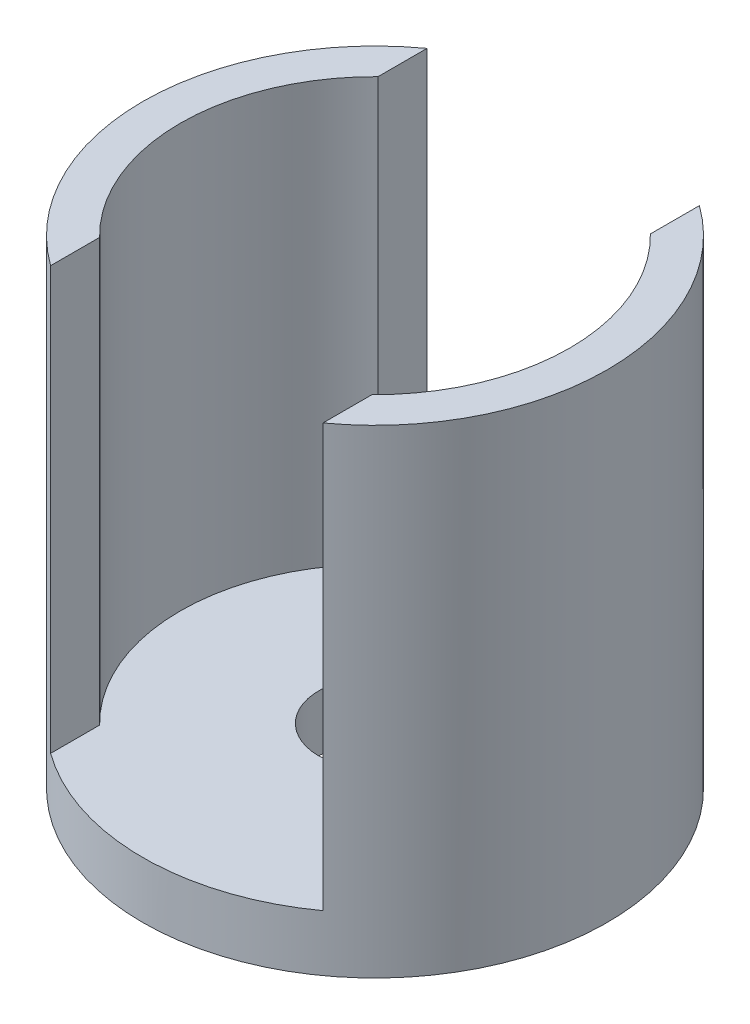
from build123d import *

# Parameters (mm, degrees)
SKETCH2_R           = 8.25
SKETCH2_R_2         = 2
BOSS_EXTRUDE1_DEPTH = 2
BOSS_EXTRUDE2_DEPTH = 15


with BuildPart() as part:
    # Sketch2 → Boss-Extrude1 (new body)
    with BuildSketch(Plane(origin=(0, 0, 0), x_dir=(1, 0, 0), z_dir=(0, 1, 0))):
        with Locations(Location((0, 0, 0), (0, 0, 270))):
            Circle(SKETCH2_R)
        with Locations(Location((0, 0, 0), (0, 0, 270))):
            Circle(SKETCH2_R_2, mode=Mode.SUBTRACT)
    extrude(amount=BOSS_EXTRUDE1_DEPTH)

    # Sketch3 → Boss-Extrude2 (add)
    with BuildSketch(Plane(origin=(0, 2, 0), x_dir=(1, 0, 0), z_dir=(0, 1, 0))):
        with BuildLine():
            ThreePointArc((-4.836821281, 6.683386858), (-8.25, 0), (-4.836821281, -6.683386858))
            Line((-4.836821281, -6.683386858), (-4.836821281, -4.942960119))
            ThreePointArc((-4.836821281, -4.942960119), (-6.915756997, 0), (-4.836821281, 4.942960119))
            Line((-4.836821281, 4.942960119), (-4.836821281, 6.683386858))
        make_face()
        with BuildLine():
            Line((4.836821281, -4.942960119), (4.836821281, -6.683386858))
            ThreePointArc((4.836821281, -6.683386858), (7.34732181, -3.752247622), (8.25, 0))
            ThreePointArc((8.25, 0), (7.34732181, 3.752247622), (4.836821281, 6.683386858))
            Line((4.836821281, 6.683386858), (4.836821281, 4.942960119))
            ThreePointArc((4.836821281, 4.942960119), (6.374871585, 2.681176442), (6.915756997, 0))
            ThreePointArc((6.915756997, 0), (6.374871585, -2.681176442), (4.836821281, -4.942960119))
        make_face()
    extrude(amount=BOSS_EXTRUDE2_DEPTH)


solid = part.part
